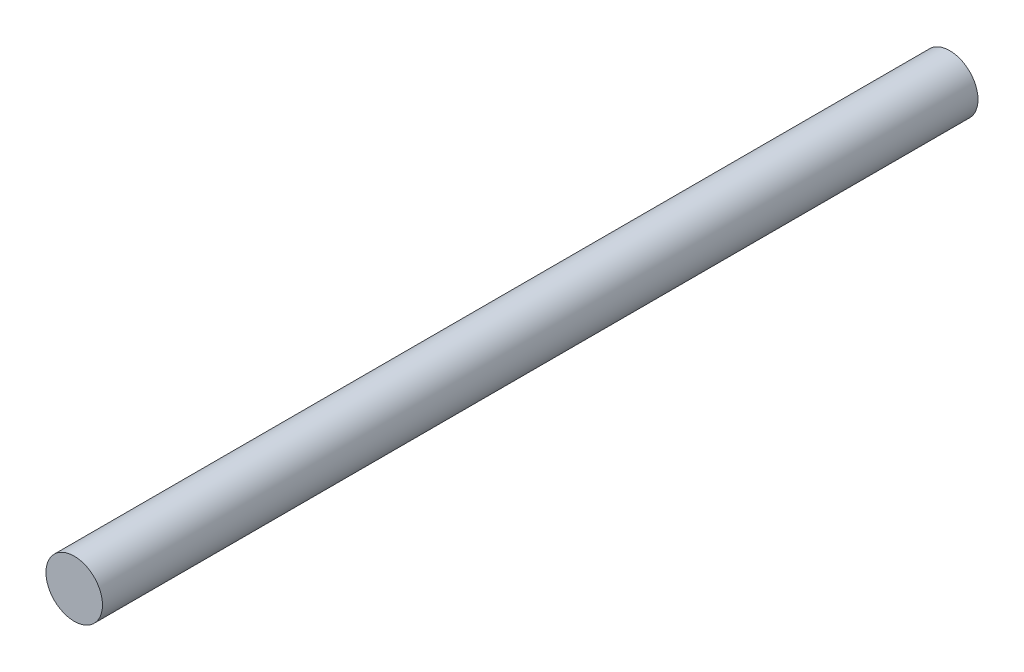
from build123d import *

# Parameters (mm, degrees)
SKETCH1_R           = 0.51
BOSS_EXTRUDE1_DEPTH = 15.8


with BuildPart() as part:
    # Sketch1 → Boss-Extrude1 (new body)
    with BuildSketch(Plane.XY):
        Circle(SKETCH1_R)
    extrude(amount=BOSS_EXTRUDE1_DEPTH)


solid = part.part
